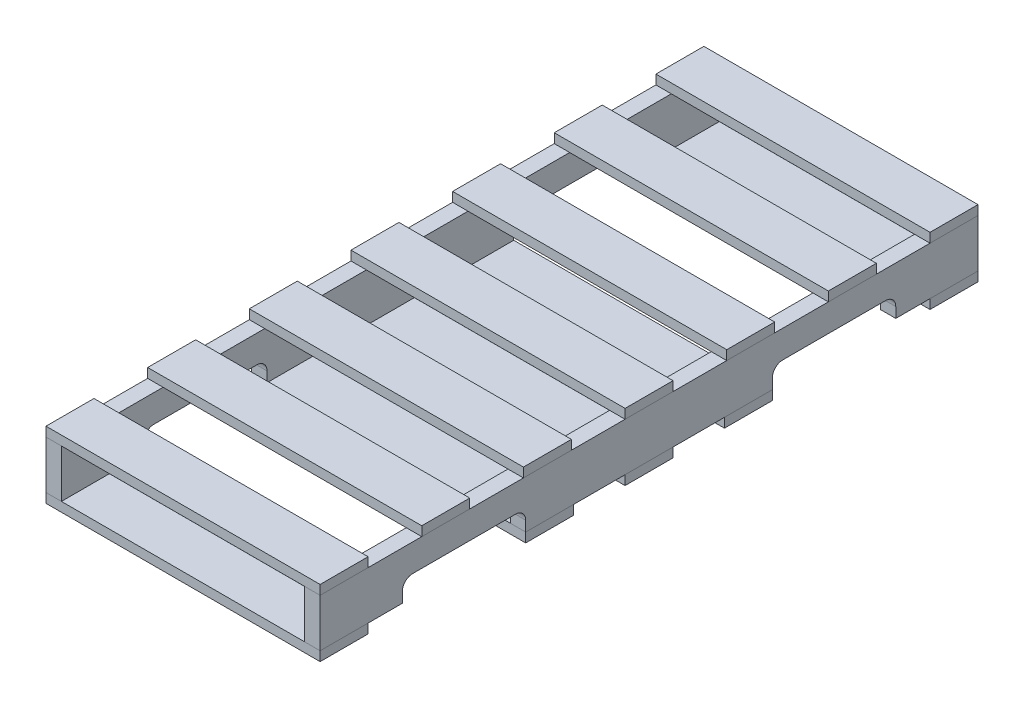
from build123d import *

# Parameters (mm, degrees)
BOSS_EXTRUDE1_DEPTH        = 609.6
BOSS_EXTRUDE1_DEPTH_BACK   = 609.6
SKETCH3_W                  = 28.575
SKETCH3_H                  = 89.0016
BOSS_EXTRUDE1_2_DEPTH      = 609.6
BOSS_EXTRUDE1_2_DEPTH_BACK = 609.6
SKETCH4_W                  = 508
SKETCH4_H                  = 88.9
BOSS_EXTRUDE2_DEPTH        = 17.4752
BOSS_EXTRUDE2_2_DEPTH      = 17.4752
BOSS_EXTRUDE2_3_DEPTH      = 17.4752
BOSS_EXTRUDE2_4_DEPTH      = 17.4752
BOSS_EXTRUDE2_5_DEPTH      = 17.4752
BOSS_EXTRUDE2_6_DEPTH      = 17.4752
BOSS_EXTRUDE2_7_DEPTH      = 17.4752
SKETCH5_W                  = 508
SKETCH5_H                  = 88.9
BOSS_EXTRUDE3_DEPTH        = 17.4752
BOSS_EXTRUDE3_2_DEPTH      = 17.4752
BOSS_EXTRUDE3_3_DEPTH      = 17.4752
BOSS_EXTRUDE3_4_DEPTH      = 17.4752
BOSS_EXTRUDE3_5_DEPTH      = 17.4752
CUT_EXTRUDE2_DEPTH         = 796.93792759
CUT_EXTRUDE2_DEPTH_BACK    = 796.93792759


with BuildPart() as part:
    # Sketch3 → Boss-Extrude1 (new, two sides: drawn at the far end of the back side and taken through both)
    with BuildSketch(Plane.XY.offset(-BOSS_EXTRUDE1_DEPTH_BACK)):
        with Locations((-239.7125, 0)):
            Rectangle(SKETCH3_W, SKETCH3_H)
    extrude(amount=BOSS_EXTRUDE1_DEPTH + BOSS_EXTRUDE1_DEPTH_BACK)


with BuildPart() as body_2:
    # Sketch3 → Boss-Extrude1 2 (new, two sides: drawn at the far end of the back side and taken through both)
    with BuildSketch(Plane.XY.offset(-BOSS_EXTRUDE1_2_DEPTH_BACK)):
        with Locations((239.7125, 0)):
            Rectangle(SKETCH3_W, SKETCH3_H)
    extrude(amount=BOSS_EXTRUDE1_2_DEPTH + BOSS_EXTRUDE1_2_DEPTH_BACK)


with BuildPart() as body_3:
    # Sketch4 → Boss-Extrude2 (new body)
    with BuildSketch(Plane(origin=(0, 44.5008, 0), x_dir=(1, 0, 0), z_dir=(0, 1, 0))):
        with Locations((0, -565.15)):
            Rectangle(SKETCH4_W, SKETCH4_H)
    extrude(amount=BOSS_EXTRUDE2_DEPTH)


with BuildPart() as body_4:
    # Sketch4 → Boss-Extrude2 2 (new body)
    with BuildSketch(Plane(origin=(0, 44.5008, 0), x_dir=(1, 0, 0), z_dir=(0, 1, 0))):
        with Locations((0, -376.766666667)):
            Rectangle(SKETCH4_W, SKETCH4_H)
    extrude(amount=BOSS_EXTRUDE2_2_DEPTH)


with BuildPart() as body_5:
    # Sketch4 → Boss-Extrude2 3 (new body)
    with BuildSketch(Plane(origin=(0, 44.5008, 0), x_dir=(1, 0, 0), z_dir=(0, 1, 0))):
        with Locations((0, -188.383333333)):
            Rectangle(SKETCH4_W, SKETCH4_H)
    extrude(amount=BOSS_EXTRUDE2_3_DEPTH)


with BuildPart() as body_6:
    # Sketch4 → Boss-Extrude2 4 (new body)
    with BuildSketch(Plane(origin=(0, 44.5008, 0), x_dir=(1, 0, 0), z_dir=(0, 1, 0))):
        Rectangle(SKETCH4_W, SKETCH4_H)
    extrude(amount=BOSS_EXTRUDE2_4_DEPTH)


with BuildPart() as body_7:
    # Sketch4 → Boss-Extrude2 5 (new body)
    with BuildSketch(Plane(origin=(0, 44.5008, 0), x_dir=(1, 0, 0), z_dir=(0, 1, 0))):
        with Locations((0, 188.383333333)):
            Rectangle(SKETCH4_W, SKETCH4_H)
    extrude(amount=BOSS_EXTRUDE2_5_DEPTH)


with BuildPart() as body_8:
    # Sketch4 → Boss-Extrude2 6 (new body)
    with BuildSketch(Plane(origin=(0, 44.5008, 0), x_dir=(1, 0, 0), z_dir=(0, 1, 0))):
        with Locations((0, 376.766666667)):
            Rectangle(SKETCH4_W, SKETCH4_H)
    extrude(amount=BOSS_EXTRUDE2_6_DEPTH)


with BuildPart() as body_9:
    # Sketch4 → Boss-Extrude2 7 (new body)
    with BuildSketch(Plane(origin=(0, 44.5008, 0), x_dir=(1, 0, 0), z_dir=(0, 1, 0))):
        with Locations((0, 565.15)):
            Rectangle(SKETCH4_W, SKETCH4_H)
    extrude(amount=BOSS_EXTRUDE2_7_DEPTH)


with BuildPart() as body_10:
    # Sketch5 → Boss-Extrude3 (new body)
    with BuildSketch(Plane.XZ.offset(44.5008)):
        with Locations((0, 565.15)):
            Rectangle(SKETCH5_W, SKETCH5_H)
    extrude(amount=BOSS_EXTRUDE3_DEPTH)


with BuildPart() as body_11:
    # Sketch5 → Boss-Extrude3 2 (new body)
    with BuildSketch(Plane.XZ.offset(44.5008)):
        with Locations((0, -565.15)):
            Rectangle(SKETCH5_W, SKETCH5_H)
    extrude(amount=BOSS_EXTRUDE3_2_DEPTH)


with BuildPart() as body_12:
    # Sketch5 → Boss-Extrude3 3 (new body)
    with BuildSketch(Plane.XZ.offset(44.5008)):
        Rectangle(SKETCH5_W, SKETCH5_H)
    extrude(amount=BOSS_EXTRUDE3_3_DEPTH)


with BuildPart() as body_13:
    # Sketch5 → Boss-Extrude3 4 (new body)
    with BuildSketch(Plane.XZ.offset(44.5008)):
        with Locations((0, 184.15)):
            Rectangle(SKETCH5_W, SKETCH5_H)
    extrude(amount=BOSS_EXTRUDE3_4_DEPTH)


with BuildPart() as body_14:
    # Sketch5 → Boss-Extrude3 5 (new body)
    with BuildSketch(Plane.XZ.offset(44.5008)):
        with Locations((0, -184.15)):
            Rectangle(SKETCH5_W, SKETCH5_H)
    extrude(amount=BOSS_EXTRUDE3_5_DEPTH)


with BuildPart() as cut_extrude2_tool:
    # Sketch8 → Cut-Extrude2 (new, two sides: drawn at the far end of the back side and taken through both)
    with BuildSketch(Plane(origin=(254, 0, 0), x_dir=(0, 0, -1), z_dir=(1, 0, 0)).offset(-CUT_EXTRUDE2_DEPTH_BACK)):
        with BuildLine():
            Line((-228.6, -44.5008), (-457.2, -44.5008))
            Line((-457.2, -44.5008), (-457.2, -25.4508))
            ThreePointArc((-457.2, -25.4508), (-451.620384182, -11.980415818), (-438.15, -6.4008))
            Line((-438.15, -6.4008), (-247.65, -6.4008))
            ThreePointArc((-247.65, -6.4008), (-234.179615818, -11.980415818), (-228.6, -25.4508))
            Line((-228.6, -25.4508), (-228.6, -44.5008))
        make_face()
        with BuildLine():
            Line((228.6, -44.5008), (457.2, -44.5008))
            Line((457.2, -44.5008), (457.2, -25.4508))
            ThreePointArc((457.2, -25.4508), (451.620384182, -11.980415818), (438.15, -6.4008))
            Line((438.15, -6.4008), (247.65, -6.4008))
            ThreePointArc((247.65, -6.4008), (234.179615818, -11.980415818), (228.6, -25.4508))
            Line((228.6, -25.4508), (228.6, -44.5008))
        make_face()
    extrude(amount=CUT_EXTRUDE2_DEPTH + CUT_EXTRUDE2_DEPTH_BACK)


with BuildPart() as part_1:
    add(part.part)

    # Cut-Extrude2: cut by cut_extrude2_tool
    add(cut_extrude2_tool.part, mode=Mode.SUBTRACT)


with BuildPart() as body_2_1:
    add(body_2.part)

    # Cut-Extrude2: cut by cut_extrude2_tool
    add(cut_extrude2_tool.part, mode=Mode.SUBTRACT)


solid = Compound([body_3.part, body_4.part, body_5.part, body_6.part, body_7.part, body_8.part, body_9.part, body_10.part, body_11.part, body_12.part, body_13.part, body_14.part, part_1.part, body_2_1.part])
